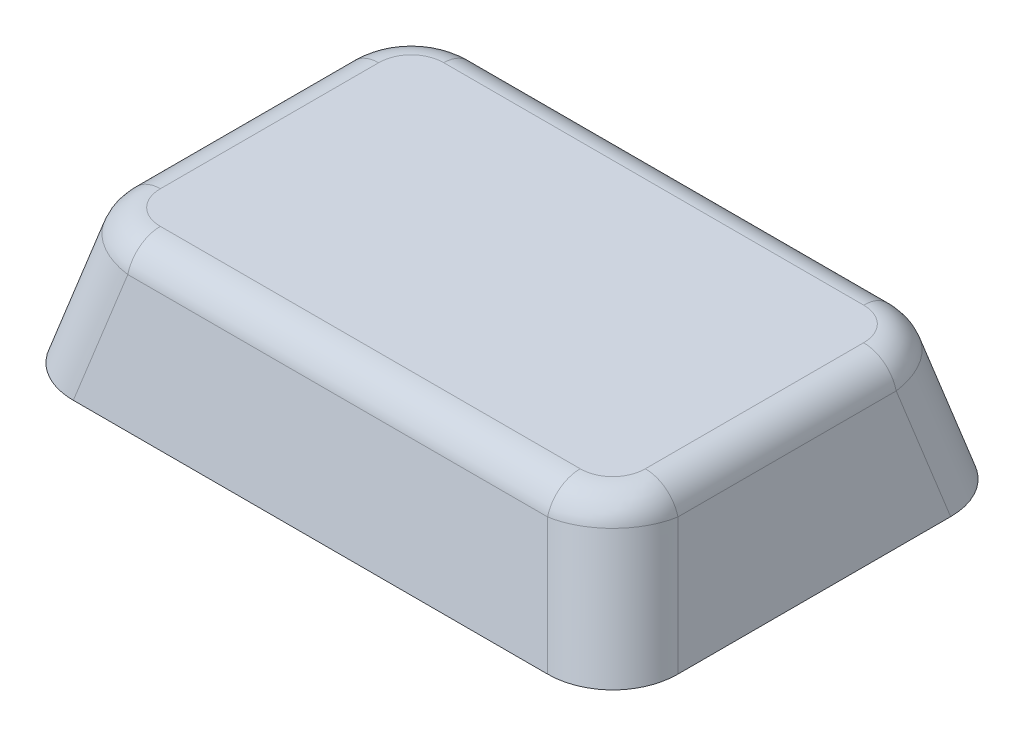
from build123d import *

# Parameters (mm, degrees)
FILLET_1_R = 1
FILLET_2_R = 1
FILLET_3_R = 1
FILLET_4_R = 1
FILLET_5_R = 0.5


with BuildPart() as part:
    # 草图1 → 放样1 section 0
    with BuildSketch(Plane(origin=(0, 0, 0), x_dir=(1, 0, 0), z_dir=(0, 1, 0))):
        with BuildLine():
            Line((-4.5, 3), (4.5, 3))
            Line((4.5, 3), (4.5, -3))
            Line((4.5, -3), (-4.5, -3))
            Line((-4.5, -3), (-4.5, 3))
        make_face()
    # 草图2 → 放样1 section 1
    with BuildSketch(Plane(origin=(0, 2, 0), x_dir=(1, 0, 0), z_dir=(0, 1, 0))):
        with BuildLine():
            Line((-4, 2.5), (4, 2.5))
            Line((4, 2.5), (4, -2.5))
            Line((4, -2.5), (-4, -2.5))
            Line((-4, -2.5), (-4, 2.5))
        make_face()
    loft()

    # 圆角1
    fillet_1_edges = [part.edges().sort_by_distance(p)[0] for p in [
        (4.25, 1, 2.75),
    ]]
    fillet(fillet_1_edges, radius=FILLET_1_R)

    # 圆角2
    fillet_2_edges = [part.edges().sort_by_distance(p)[0] for p in [
        (-4.25, 1, 2.75),
    ]]
    fillet(fillet_2_edges, radius=FILLET_2_R)

    # 圆角3
    fillet_3_edges = [part.edges().sort_by_distance(p)[0] for p in [
        (-4.25, 1, -2.75),
    ]]
    fillet(fillet_3_edges, radius=FILLET_3_R)

    # 圆角4
    fillet_4_edges = [part.edges().sort_by_distance(p)[0] for p in [
        (4.25, 1, -2.75),
    ]]
    fillet(fillet_4_edges, radius=FILLET_4_R)

    # 圆角5
    fillet_5_edges = [part.edges().sort_by_distance(p)[0] for p in [
        (3.719223594, 2, -2.219223593),
        (4, 2, 0),
        (3.719223593, 2, 2.219223594),
        (0, 2, 2.5),
        (-3.719223594, 2, 2.219223593),
        (-4, 2, 0),
        (-3.719223593, 2, -2.219223594),
        (0, 2, -2.5),
    ]]
    fillet(fillet_5_edges, radius=FILLET_5_R)


solid = part.part
